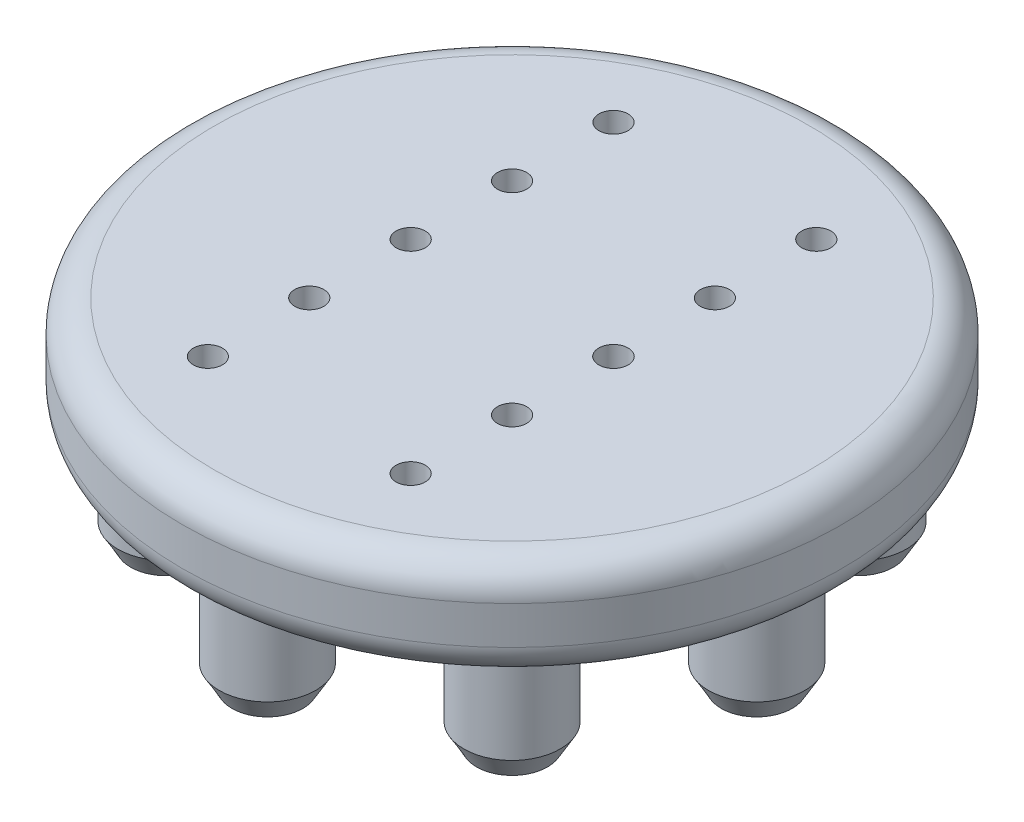
from build123d import *
from OCP.BRepFilletAPI import BRepFilletAPI_MakeChamfer

# Parameters (mm, degrees)
SKETCH1_R           = 26
BOSS_EXTRUDE1_DEPTH = 8
SKETCH2_R           = 6.1
CUT_EXTRUDE2_DEPTH  = 3
SKETCH1_11_R        = 3.8
BOSS_EXTRUDE3_DEPTH = 9
FILLET1_R           = 2.5
SKETCH3_R           = 1.15
SKETCH3_R_2         = 1.160199873
CUT_EXTRUDE3_DEPTH  = 6
CHAMFER1_SIZE       = 1
CHAMFER1_SIZE2      = 1.732050808


with BuildPart() as part:
    # Sketch1 → Boss-Extrude1 (new body)
    with BuildSketch(Plane(origin=(0, 0, 0), x_dir=(1, 0, 0), z_dir=(0, 1, 0))):
        Circle(SKETCH1_R)
    extrude(amount=BOSS_EXTRUDE1_DEPTH)

    # Sketch2 → Cut-Extrude2 (cut)
    with BuildSketch(Plane.XZ):
        Circle(SKETCH2_R)
    extrude(amount=-CUT_EXTRUDE2_DEPTH, mode=Mode.SUBTRACT)

    # Sketch1<11> → Boss-Extrude3 (add)
    with BuildSketch(Plane(origin=(0, 0, 0), x_dir=(1, 0, 0), z_dir=(0, 1, 0))):
        with Locations((-13.647160877, 13.647160877)):
            Circle(SKETCH1_11_R)
        with Locations((0, 19.3)):
            Circle(SKETCH1_11_R)
        with Locations((13.647160877, 13.647160877)):
            Circle(SKETCH1_11_R)
        with Locations((19.3, 0)):
            Circle(SKETCH1_11_R)
        with Locations((13.647160877, -13.647160877)):
            Circle(SKETCH1_11_R)
        with Locations((0, -19.3)):
            Circle(SKETCH1_11_R)
        with Locations((-13.647160877, -13.647160877)):
            Circle(SKETCH1_11_R)
        with Locations((-19.3, 0)):
            Circle(SKETCH1_11_R)
    extrude(amount=-BOSS_EXTRUDE3_DEPTH)

    # Fillet1
    fillet1_edges = [part.edges().sort_by_distance(p)[0] for p in [
        (-26, 0, 0),
        (-26, 8, 0),
    ]]
    fillet(fillet1_edges, radius=FILLET1_R)

    # Sketch3 → Cut-Extrude3 (cut)
    with BuildSketch(Plane(origin=(0, 8, 0), x_dir=(1, 0, 0), z_dir=(0, 1, 0))):
        with Locations((-8, 16)):
            Circle(SKETCH3_R)
        with Locations((8, 16)):
            Circle(SKETCH3_R)
        with Locations((-8, 8)):
            Circle(SKETCH3_R)
        with Locations((8, 8)):
            Circle(SKETCH3_R)
        with Locations((-8, -8)):
            Circle(SKETCH3_R)
        with Locations((8, -8)):
            Circle(SKETCH3_R)
        with Locations((-8, -16)):
            Circle(SKETCH3_R)
        with Locations((8, -16)):
            Circle(SKETCH3_R)
        with Locations((-8, 0)):
            Circle(SKETCH3_R)
        with Locations((8, 0)):
            Circle(SKETCH3_R_2)
    extrude(amount=-CUT_EXTRUDE3_DEPTH, mode=Mode.SUBTRACT)

    # Chamfer1: one chamfer whose edges measure the first distance from different faces: ONE call of the kernel's chamfer builder (chamfer() names one face for all edges)
    chamfer1_edges_1 = [part.edges().sort_by_distance(p)[0] for p in [
        (-17.447160877, -9, -13.647160877),
    ]]
    chamfer1_side_1 = [part.faces().sort_by_distance(p)[0] for p in [
        (-13.647160877, -9, -13.647160877),
    ]]
    chamfer1_edges_2 = [part.edges().sort_by_distance(p)[0] for p in [
        (-3.8, -9, -19.3),
    ]]
    chamfer1_side_2 = [part.faces().sort_by_distance(p)[0] for p in [
        (0, -9, -19.3),
    ]]
    chamfer1_edges_3 = [part.edges().sort_by_distance(p)[0] for p in [
        (9.847160877, -9, -13.647160877),
    ]]
    chamfer1_side_3 = [part.faces().sort_by_distance(p)[0] for p in [
        (13.647160877, -9, -13.647160877),
    ]]
    chamfer1_edges_4 = [part.edges().sort_by_distance(p)[0] for p in [
        (15.5, -9, 0),
    ]]
    chamfer1_side_4 = [part.faces().sort_by_distance(p)[0] for p in [
        (19.3, -9, 0),
    ]]
    chamfer1_edges_5 = [part.edges().sort_by_distance(p)[0] for p in [
        (9.847160877, -9, 13.647160877),
    ]]
    chamfer1_side_5 = [part.faces().sort_by_distance(p)[0] for p in [
        (13.647160877, -9, 13.647160877),
    ]]
    chamfer1_edges_6 = [part.edges().sort_by_distance(p)[0] for p in [
        (-3.8, -9, 19.3),
    ]]
    chamfer1_side_6 = [part.faces().sort_by_distance(p)[0] for p in [
        (0, -9, 19.3),
    ]]
    chamfer1_edges_7 = [part.edges().sort_by_distance(p)[0] for p in [
        (-17.447160877, -9, 13.647160877),
    ]]
    chamfer1_side_7 = [part.faces().sort_by_distance(p)[0] for p in [
        (-13.647160877, -9, 13.647160877),
    ]]
    chamfer1_edges_8 = [part.edges().sort_by_distance(p)[0] for p in [
        (-23.1, -9, 0),
    ]]
    chamfer1_side_8 = [part.faces().sort_by_distance(p)[0] for p in [
        (-19.3, -9, 0),
    ]]
    chamfer1 = BRepFilletAPI_MakeChamfer(part.part.solid().wrapped)
    for e in chamfer1_edges_1:
        chamfer1.Add(CHAMFER1_SIZE, CHAMFER1_SIZE2, e.wrapped, chamfer1_side_1[0].wrapped)  # the first distance lies on this face
    for e in chamfer1_edges_2:
        chamfer1.Add(CHAMFER1_SIZE, CHAMFER1_SIZE2, e.wrapped, chamfer1_side_2[0].wrapped)  # the first distance lies on this face
    for e in chamfer1_edges_3:
        chamfer1.Add(CHAMFER1_SIZE, CHAMFER1_SIZE2, e.wrapped, chamfer1_side_3[0].wrapped)  # the first distance lies on this face
    for e in chamfer1_edges_4:
        chamfer1.Add(CHAMFER1_SIZE, CHAMFER1_SIZE2, e.wrapped, chamfer1_side_4[0].wrapped)  # the first distance lies on this face
    for e in chamfer1_edges_5:
        chamfer1.Add(CHAMFER1_SIZE, CHAMFER1_SIZE2, e.wrapped, chamfer1_side_5[0].wrapped)  # the first distance lies on this face
    for e in chamfer1_edges_6:
        chamfer1.Add(CHAMFER1_SIZE, CHAMFER1_SIZE2, e.wrapped, chamfer1_side_6[0].wrapped)  # the first distance lies on this face
    for e in chamfer1_edges_7:
        chamfer1.Add(CHAMFER1_SIZE, CHAMFER1_SIZE2, e.wrapped, chamfer1_side_7[0].wrapped)  # the first distance lies on this face
    for e in chamfer1_edges_8:
        chamfer1.Add(CHAMFER1_SIZE, CHAMFER1_SIZE2, e.wrapped, chamfer1_side_8[0].wrapped)  # the first distance lies on this face
    add(Compound.cast(chamfer1.Shape()), mode=Mode.REPLACE)


solid = part.part
